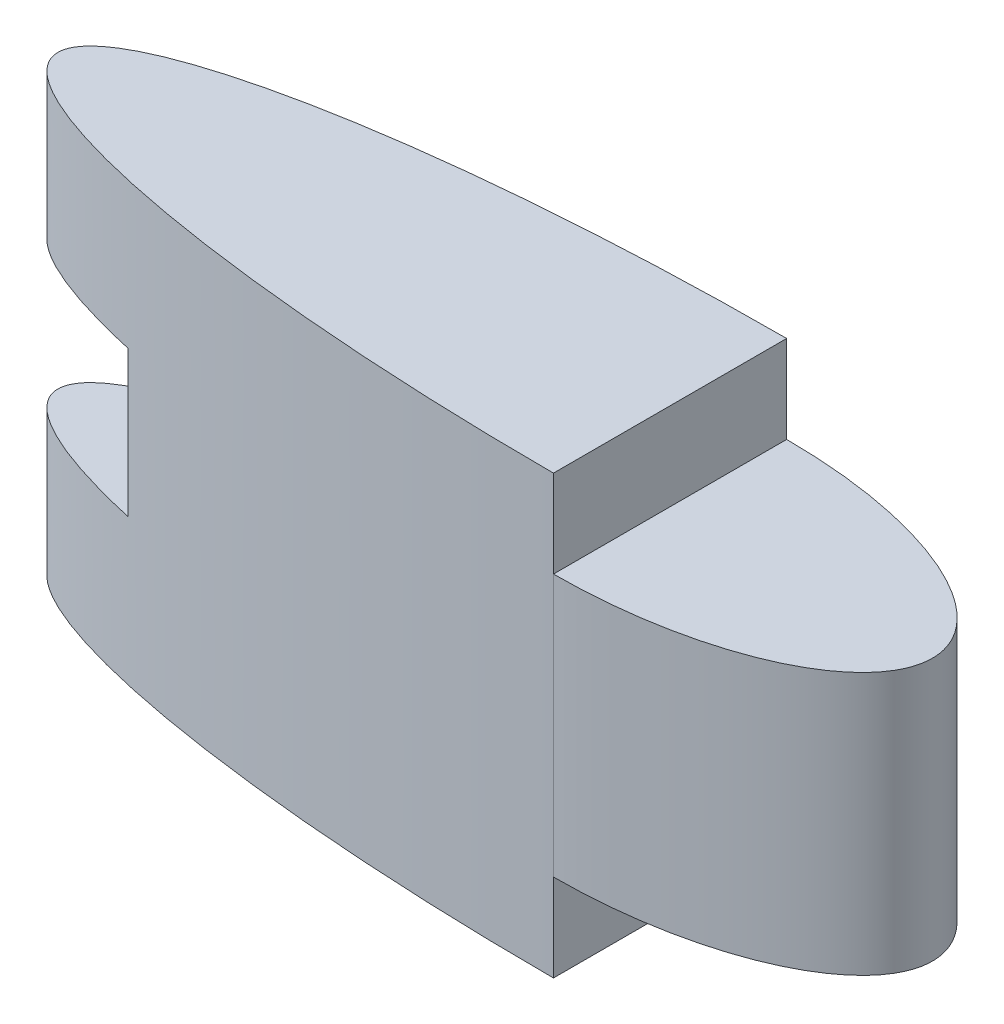
from build123d import *

# Parameters (mm, degrees)
BOSS_EXTRUDE1_DEPTH            = 150
CUT_EXTRUDE1_REACH             = 263.151
SKETCH3_W                      = 90
SKETCH3_H                      = 30
SKETCH3_W_2                    = 50
SKETCH3_H_2                    = 50
CUT_EXTRUDE1_DIRECTION_2_REACH = 263.151


with BuildPart() as part:
    # Sketch1 → Boss-Extrude1 (new body)
    with BuildSketch(Plane(origin=(0, 0, 0), x_dir=(1, 0, 0), z_dir=(0, 1, 0))):
        with BuildLine():
            add(Edge.make_bspline(
                [(0, -40), (90, -40), (90, 0), (90, 40), (0, 40)],
                knots=[1.570796327, 1.570796327, 1.570796327, 3.141592654, 3.141592654, 4.71238898, 4.71238898, 4.71238898], degree=2, weights=[1, 0.707106781, 1, 0.707106781, 1]))
            add(Edge.make_bspline(
                [(0, 40), (-210, 40), (-210, 0), (-210, -40), (0, -40)],
                knots=[1.570796327, 1.570796327, 1.570796327, 3.141592654, 3.141592654, 4.71238898, 4.71238898, 4.71238898], degree=2, weights=[1, 0.707106781, 1, 0.707106781, 1]))
        make_face()
    extrude(amount=BOSS_EXTRUDE1_DEPTH)

    # Sketch3 → Cut-Extrude1 (cut, up to next)
    with BuildSketch(Plane.XY, mode=Mode.PRIVATE) as cut_extrude1_sk1:
        with Locations((45, 135)):
            Rectangle(SKETCH3_W, SKETCH3_H)
    cut_extrude1_tool1 = extrude(cut_extrude1_sk1.sketch, amount=-CUT_EXTRUDE1_REACH, mode=Mode.PRIVATE) & part.part
    # Sketch3 → Cut-Extrude1 (cut, up to next)
    with BuildSketch(Plane.XY, mode=Mode.PRIVATE) as cut_extrude1_sk2:
        with Locations((45, 15)):
            Rectangle(SKETCH3_W, SKETCH3_H)
    cut_extrude1_tool2 = extrude(cut_extrude1_sk2.sketch, amount=-CUT_EXTRUDE1_REACH, mode=Mode.PRIVATE) & part.part
    # Sketch3 → Cut-Extrude1 (cut, up to next)
    with BuildSketch(Plane.XY, mode=Mode.PRIVATE) as cut_extrude1_sk3:
        with Locations((-185, 75)):
            Rectangle(SKETCH3_W_2, SKETCH3_H_2)
    cut_extrude1_tool3 = extrude(cut_extrude1_sk3.sketch, amount=-CUT_EXTRUDE1_REACH, mode=Mode.PRIVATE) & part.part
    add(cut_extrude1_tool1.solids().sort_by_distance((45, 135, 0))[0], mode=Mode.SUBTRACT)
    add(cut_extrude1_tool2.solids().sort_by_distance((45, 15, 0))[0], mode=Mode.SUBTRACT)
    add(cut_extrude1_tool3.solids().sort_by_distance((-185, 75, 0))[0], mode=Mode.SUBTRACT)

    # Sketch3 → Cut-Extrude1 direction 2 (cut, up to next)
    with BuildSketch(Plane.XY, mode=Mode.PRIVATE) as cut_extrude1_direction_2_sk1:
        with Locations((45, 135)):
            Rectangle(SKETCH3_W, SKETCH3_H)
    cut_extrude1_direction_2_tool1 = extrude(cut_extrude1_direction_2_sk1.sketch, amount=CUT_EXTRUDE1_DIRECTION_2_REACH, mode=Mode.PRIVATE) & part.part
    # Sketch3 → Cut-Extrude1 direction 2 (cut, up to next)
    with BuildSketch(Plane.XY, mode=Mode.PRIVATE) as cut_extrude1_direction_2_sk2:
        with Locations((45, 15)):
            Rectangle(SKETCH3_W, SKETCH3_H)
    cut_extrude1_direction_2_tool2 = extrude(cut_extrude1_direction_2_sk2.sketch, amount=CUT_EXTRUDE1_DIRECTION_2_REACH, mode=Mode.PRIVATE) & part.part
    # Sketch3 → Cut-Extrude1 direction 2 (cut, up to next)
    with BuildSketch(Plane.XY, mode=Mode.PRIVATE) as cut_extrude1_direction_2_sk3:
        with Locations((-185, 75)):
            Rectangle(SKETCH3_W_2, SKETCH3_H_2)
    cut_extrude1_direction_2_tool3 = extrude(cut_extrude1_direction_2_sk3.sketch, amount=CUT_EXTRUDE1_DIRECTION_2_REACH, mode=Mode.PRIVATE) & part.part
    add(cut_extrude1_direction_2_tool1.solids().sort_by_distance((45, 135, 0))[0], mode=Mode.SUBTRACT)
    add(cut_extrude1_direction_2_tool2.solids().sort_by_distance((45, 15, 0))[0], mode=Mode.SUBTRACT)
    add(cut_extrude1_direction_2_tool3.solids().sort_by_distance((-185, 75, 0))[0], mode=Mode.SUBTRACT)


solid = part.part
